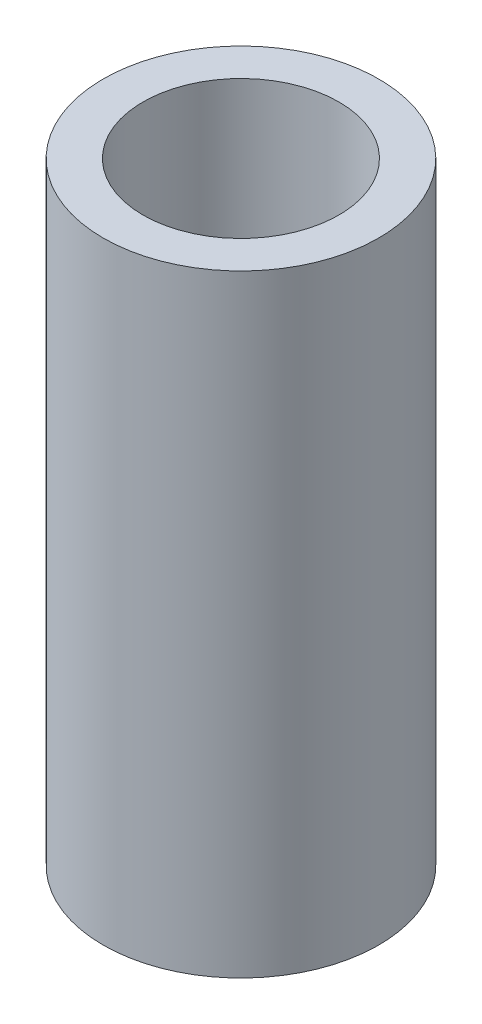
from build123d import *

# Parameters (mm, degrees)
SKETCH1_R           = 2.25
SKETCH1_R_2         = 1.6
BOSS_EXTRUDE1_DEPTH = 10


with BuildPart() as part:
    # Sketch1 → Boss-Extrude1 (new body)
    with BuildSketch(Plane(origin=(0, 0, 0), x_dir=(1, 0, 0), z_dir=(0, 1, 0))):
        with Locations(Location((0, 0, 0), (0, 0, 270))):
            Circle(SKETCH1_R)
        with Locations(Location((0, 0, 0), (0, 0, 270))):
            Circle(SKETCH1_R_2, mode=Mode.SUBTRACT)
    extrude(amount=BOSS_EXTRUDE1_DEPTH)


solid = part.part
